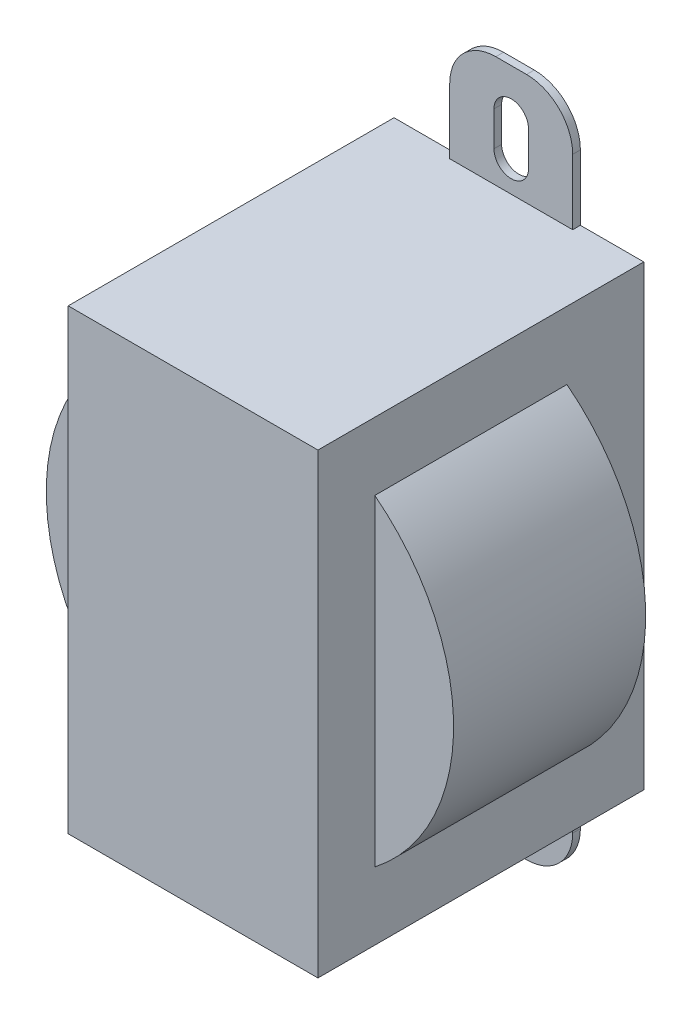
from build123d import *

# Parameters (mm, degrees)
SKETCH_1_W      = 32.5
SKETCH_1_H      = 59.5
EXTRUDE_1_DEPTH = 42.4
EXTRUDE_2_DEPTH = 25
EXTRUDE_3_DEPTH = 1


with BuildPart() as part:
    # 草图1 → 拉伸1 (new body)
    with BuildSketch(Plane.XY):
        Rectangle(SKETCH_1_W, SKETCH_1_H)
    extrude(amount=EXTRUDE_1_DEPTH)

    # 草图2 → 拉伸2 (add)
    with BuildSketch(Plane.XY.offset(10)):
        with BuildLine():
            Line((-16.25, 20.932928605), (16.25, 20.932928605))
            ThreePointArc((16.25, 20.932928605), (26.5, 0), (16.25, -20.932928605))
            Line((16.25, -20.932928605), (-16.25, -20.932928605))
            ThreePointArc((-16.25, -20.932928605), (-26.5, 0), (-16.25, 20.932928605))
        make_face()
    extrude(amount=EXTRUDE_2_DEPTH)

    # 草图4 → 拉伸3 (add)
    # profile 1 of 2: a face of its own
    with BuildSketch(Plane.XY):
        with BuildLine():
            Line((-2, 44.25), (2, 44.25))
            ThreePointArc((2, 44.25), (6.242640687, 42.492640687), (8, 38.25))
            Line((8, 38.25), (8, 29.75))
            Line((8, 29.75), (-8, 29.75))
            Line((-8, 29.75), (-8, 38.25))
            ThreePointArc((-8, 38.25), (-6.242640687, 42.492640687), (-2, 44.25))
        make_face()
        with BuildLine():
            Line((-2.25, 38.25), (-2.25, 33.75))
            ThreePointArc((-2.25, 33.75), (0, 31.5), (2.25, 33.75))
            Line((2.25, 33.75), (2.25, 38.25))
            ThreePointArc((2.25, 38.25), (0, 40.5), (-2.25, 38.25))
        make_face(mode=Mode.SUBTRACT)
    # profile 2 of 2: a face of its own
    with BuildSketch(Plane.XY):
        with BuildLine():
            Line((-2, -44.25), (2, -44.25))
            ThreePointArc((2, -44.25), (6.242640687, -42.492640687), (8, -38.25))
            Line((8, -38.25), (8, -29.75))
            Line((8, -29.75), (-8, -29.75))
            Line((-8, -29.75), (-8, -38.25))
            ThreePointArc((-8, -38.25), (-6.242640687, -42.492640687), (-2, -44.25))
        make_face()
        with BuildLine():
            Line((2.25, -38.25), (2.25, -33.75))
            ThreePointArc((2.25, -33.75), (0, -31.5), (-2.25, -33.75))
            Line((-2.25, -33.75), (-2.25, -38.25))
            ThreePointArc((-2.25, -38.25), (0, -40.5), (2.25, -38.25))
        make_face(mode=Mode.SUBTRACT)
    extrude(amount=EXTRUDE_3_DEPTH)


solid = part.part
